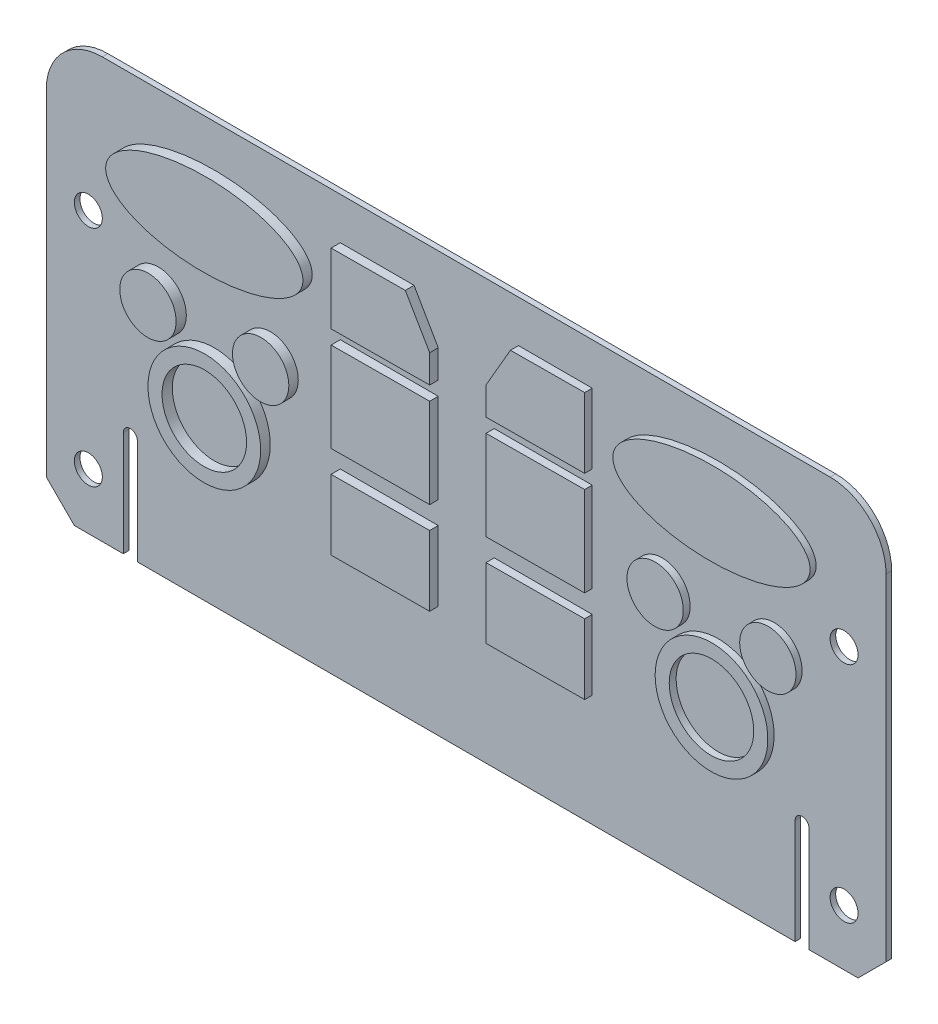
from build123d import *

# Parameters (mm, degrees)
SKETCH1_W           = 300
SKETCH1_H           = 150
PCB_BASE_DEPTH      = 2
SKETCH4_R           = 10
SKETCH4_R_2         = 20
SKETCH4_R_3         = 15
SKETCH4_RX          = 35
SKETCH4_RY          = 15
SKETCH4_W           = 35
SKETCH4_H           = 25
SKETCH4_H_2         = 32
BOSS_EXTRUDE3_DEPTH = 4
CUT_EXTRUDE1_REACH  = 337.461
SKETCH5_R           = 5
SKETCH5_W           = 5
SKETCH5_H           = 37.5
FILLET1_R           = 20
SKETCH6_W           = 2
SKETCH6_H           = 25
CUT_EXTRUDE2_DEPTH  = 0.01


with BuildPart() as part:
    # Sketch1 → PCB Base (new body)
    with BuildSketch(Plane.XY):
        with Locations((-150, 75)):
            Rectangle(SKETCH1_W, SKETCH1_H)
    extrude(amount=PCB_BASE_DEPTH)

    # Sketch4 → Boss-Extrude3 (add)
    # profile 1 of 14: a face of its own
    with BuildSketch(Plane(origin=(0, 0, 0), x_dir=(-1, 0, 0), z_dir=(0, 0, -1))):
        with Locations(Location((40, 85, 0), (0, 0, 180))):
            Circle(SKETCH4_R)
    # profile 2 of 14: a face of its own
    with BuildSketch(Plane(origin=(0, 0, 0), x_dir=(-1, 0, 0), z_dir=(0, 0, -1))):
        with Locations(Location((80, 85, 0), (0, 0, 180))):
            Circle(SKETCH4_R)
    # profile 3 of 14: a face of its own
    with BuildSketch(Plane(origin=(0, 0, 0), x_dir=(-1, 0, 0), z_dir=(0, 0, -1))):
        with Locations(Location((60, 60, 0), (0, 0, 180))):
            Circle(SKETCH4_R_2)
        with Locations((60, 60)):
            Circle(SKETCH4_R_3, mode=Mode.SUBTRACT)
    # profile 4 of 14: a face of its own
    with BuildSketch(Plane(origin=(0, 0, 0), x_dir=(-1, 0, 0), z_dir=(0, 0, -1))):
        with Locations(Location((240, 60, 0), (0, 0, 180))):
            Circle(SKETCH4_R_2)
        with Locations(Location((240, 60, 0), (0, 0, 180))):
            Circle(SKETCH4_R_3, mode=Mode.SUBTRACT)
    # profile 5 of 14: a face of its own
    with BuildSketch(Plane(origin=(0, 0, 0), x_dir=(-1, 0, 0), z_dir=(0, 0, -1))):
        with Locations(Location((220, 85, 0), (0, 0, 180))):
            Circle(SKETCH4_R)
    # profile 6 of 14: a face of its own
    with BuildSketch(Plane(origin=(0, 0, 0), x_dir=(-1, 0, 0), z_dir=(0, 0, -1))):
        with Locations(Location((260, 85, 0), (0, 0, 180))):
            Circle(SKETCH4_R)
    # profile 7 of 14: a face of its own
    with BuildSketch(Plane(origin=(0, 0, 0), x_dir=(-1, 0, 0), z_dir=(0, 0, -1))):
        with Locations((60, 120)):
            Ellipse(SKETCH4_RX, SKETCH4_RY)
    # profile 8 of 14: a face of its own
    with BuildSketch(Plane(origin=(0, 0, 0), x_dir=(-1, 0, 0), z_dir=(0, 0, -1))):
        with Locations(Location((240, 120), (0, 0, 180))):
            Ellipse(SKETCH4_RX, SKETCH4_RY)
    # profile 9 of 14: a face of its own
    with BuildSketch(Plane(origin=(0, 0, 0), x_dir=(-1, 0, 0), z_dir=(0, 0, -1))):
        Polygon((140, 120), (131.339745962, 135), (105, 135), (105, 110), (140, 110), align=None)
    # profile 10 of 14: a face of its own
    with BuildSketch(Plane(origin=(0, 0, 0), x_dir=(-1, 0, 0), z_dir=(0, 0, -1))):
        with Locations((122.5, 52.5)):
            Rectangle(SKETCH4_W, SKETCH4_H)
    # profile 11 of 14: a face of its own
    with BuildSketch(Plane(origin=(0, 0, 0), x_dir=(-1, 0, 0), z_dir=(0, 0, -1))):
        with Locations((122.5, 89)):
            Rectangle(SKETCH4_W, SKETCH4_H_2)
    # profile 12 of 14: a face of its own
    with BuildSketch(Plane(origin=(0, 0, 0), x_dir=(-1, 0, 0), z_dir=(0, 0, -1))):
        Polygon((160, 110), (160, 120), (168.660254038, 135), (195, 135), (195, 110), align=None)
    # profile 13 of 14: a face of its own
    with BuildSketch(Plane(origin=(0, 0, 0), x_dir=(-1, 0, 0), z_dir=(0, 0, -1))):
        with Locations((177.5, 89)):
            Rectangle(SKETCH4_W, SKETCH4_H_2)
    # profile 14 of 14: a face of its own
    with BuildSketch(Plane(origin=(0, 0, 0), x_dir=(-1, 0, 0), z_dir=(0, 0, -1))):
        with Locations((177.5, 52.5)):
            Rectangle(SKETCH4_W, SKETCH4_H)
    boss_extrude3 = extrude(amount=BOSS_EXTRUDE3_DEPTH)

    # Mirror1: Boss-Extrude3 across plane
    add(boss_extrude3.mirror(Plane(origin=(0, 0, 0), x_dir=(0.9999944444907404, 0, -0.0033333148149691356), z_dir=(-0.0033333148149691347, 0, -0.9999944444907405))))

    # Sketch5 → Cut-Extrude1 (cut, up to next)
    with BuildSketch(Plane(origin=(0, 0, 0), x_dir=(-1, 0, 0), z_dir=(0, 0, -1)), mode=Mode.PRIVATE) as cut_extrude1_sk1:
        with Locations((15, 100)):
            Circle(SKETCH5_R)
    cut_extrude1_tool1 = extrude(cut_extrude1_sk1.sketch, amount=-CUT_EXTRUDE1_REACH, mode=Mode.PRIVATE) & part.part
    # Sketch5 → Cut-Extrude1 (cut, up to next)
    with BuildSketch(Plane(origin=(0, 0, 0), x_dir=(-1, 0, 0), z_dir=(0, 0, -1)), mode=Mode.PRIVATE) as cut_extrude1_sk2:
        with Locations((15, 20)):
            Circle(SKETCH5_R)
    cut_extrude1_tool2 = extrude(cut_extrude1_sk2.sketch, amount=-CUT_EXTRUDE1_REACH, mode=Mode.PRIVATE) & part.part
    # Sketch5 → Cut-Extrude1 (cut, up to next)
    with BuildSketch(Plane(origin=(0, 0, 0), x_dir=(-1, 0, 0), z_dir=(0, 0, -1)), mode=Mode.PRIVATE) as cut_extrude1_sk3:
        Polygon((0, 0), (10, 0), (0, 10), align=None)
    cut_extrude1_tool3 = extrude(cut_extrude1_sk3.sketch, amount=-CUT_EXTRUDE1_REACH, mode=Mode.PRIVATE) & part.part
    # Sketch5 → Cut-Extrude1 (cut, up to next)
    with BuildSketch(Plane(origin=(0, 0, 0), x_dir=(-1, 0, 0), z_dir=(0, 0, -1)), mode=Mode.PRIVATE) as cut_extrude1_sk4:
        with Locations((30, 18.75)):
            Rectangle(SKETCH5_W, SKETCH5_H)
    cut_extrude1_tool4 = extrude(cut_extrude1_sk4.sketch, amount=-CUT_EXTRUDE1_REACH, mode=Mode.PRIVATE) & part.part
    # Sketch5 → Cut-Extrude1 (cut, up to next)
    with BuildSketch(Plane(origin=(0, 0, 0), x_dir=(-1, 0, 0), z_dir=(0, 0, -1)), mode=Mode.PRIVATE) as cut_extrude1_sk5:
        with BuildLine():
            Line((27.5, 37.5), (32.5, 37.5))
            ThreePointArc((32.5, 37.5), (30, 40), (27.5, 37.5))
        make_face()
    cut_extrude1_tool5 = extrude(cut_extrude1_sk5.sketch, amount=-CUT_EXTRUDE1_REACH, mode=Mode.PRIVATE) & part.part
    # Sketch5 → Cut-Extrude1 (cut, up to next)
    with BuildSketch(Plane(origin=(0, 0, 0), x_dir=(-1, 0, 0), z_dir=(0, 0, -1)), mode=Mode.PRIVATE) as cut_extrude1_sk6:
        with Locations((285, 100)):
            Circle(SKETCH5_R)
    cut_extrude1_tool6 = extrude(cut_extrude1_sk6.sketch, amount=-CUT_EXTRUDE1_REACH, mode=Mode.PRIVATE) & part.part
    # Sketch5 → Cut-Extrude1 (cut, up to next)
    with BuildSketch(Plane(origin=(0, 0, 0), x_dir=(-1, 0, 0), z_dir=(0, 0, -1)), mode=Mode.PRIVATE) as cut_extrude1_sk7:
        with Locations((285, 20)):
            Circle(SKETCH5_R)
    cut_extrude1_tool7 = extrude(cut_extrude1_sk7.sketch, amount=-CUT_EXTRUDE1_REACH, mode=Mode.PRIVATE) & part.part
    # Sketch5 → Cut-Extrude1 (cut, up to next)
    with BuildSketch(Plane(origin=(0, 0, 0), x_dir=(-1, 0, 0), z_dir=(0, 0, -1)), mode=Mode.PRIVATE) as cut_extrude1_sk8:
        Polygon((300, 10), (290, 0), (300, 0), align=None)
    cut_extrude1_tool8 = extrude(cut_extrude1_sk8.sketch, amount=-CUT_EXTRUDE1_REACH, mode=Mode.PRIVATE) & part.part
    # Sketch5 → Cut-Extrude1 (cut, up to next)
    with BuildSketch(Plane(origin=(0, 0, 0), x_dir=(-1, 0, 0), z_dir=(0, 0, -1)), mode=Mode.PRIVATE) as cut_extrude1_sk9:
        with Locations((270, 18.75)):
            Rectangle(SKETCH5_W, SKETCH5_H)
    cut_extrude1_tool9 = extrude(cut_extrude1_sk9.sketch, amount=-CUT_EXTRUDE1_REACH, mode=Mode.PRIVATE) & part.part
    # Sketch5 → Cut-Extrude1 (cut, up to next)
    with BuildSketch(Plane(origin=(0, 0, 0), x_dir=(-1, 0, 0), z_dir=(0, 0, -1)), mode=Mode.PRIVATE) as cut_extrude1_sk10:
        with BuildLine():
            ThreePointArc((267.5, 37.5), (270, 40), (272.5, 37.5))
            Line((272.5, 37.5), (267.5, 37.5))
        make_face()
    cut_extrude1_tool10 = extrude(cut_extrude1_sk10.sketch, amount=-CUT_EXTRUDE1_REACH, mode=Mode.PRIVATE) & part.part
    add(cut_extrude1_tool1.solids().sort_by_distance((-15, 100, 0))[0], mode=Mode.SUBTRACT)
    add(cut_extrude1_tool2.solids().sort_by_distance((-15, 20, 0))[0], mode=Mode.SUBTRACT)
    add(cut_extrude1_tool3.solids().sort_by_distance((-3.333333, 3.333333, 0))[0], mode=Mode.SUBTRACT)
    add(cut_extrude1_tool4.solids().sort_by_distance((-30, 18.75, 0))[0], mode=Mode.SUBTRACT)
    add(cut_extrude1_tool5.solids().sort_by_distance((-30, 38.561033, 0))[0], mode=Mode.SUBTRACT)
    add(cut_extrude1_tool6.solids().sort_by_distance((-285, 100, 0))[0], mode=Mode.SUBTRACT)
    add(cut_extrude1_tool7.solids().sort_by_distance((-285, 20, 0))[0], mode=Mode.SUBTRACT)
    add(cut_extrude1_tool8.solids().sort_by_distance((-296.666667, 3.333333, 0))[0], mode=Mode.SUBTRACT)
    add(cut_extrude1_tool9.solids().sort_by_distance((-270, 18.75, 0))[0], mode=Mode.SUBTRACT)
    add(cut_extrude1_tool10.solids().sort_by_distance((-270, 38.561033, 0))[0], mode=Mode.SUBTRACT)

    # Fillet1
    fillet1_edges = [part.edges().sort_by_distance(p)[0] for p in [
        (-300, 150, 1),
        (0, 150, 1),
    ]]
    fillet(fillet1_edges, radius=FILLET1_R)

    # Sketch6 → Cut-Extrude2 (cut)
    with BuildSketch(Plane(origin=(0, 0, 0), x_dir=(-1, 0, 0), z_dir=(0, 0, -1))):
        with Locations((40, 12.5)):
            Rectangle(SKETCH6_W, SKETCH6_H)
        with Locations((45, 12.5)):
            Rectangle(SKETCH6_W, SKETCH6_H)
        with Locations((50, 12.5)):
            Rectangle(SKETCH6_W, SKETCH6_H)
        with Locations((55, 12.5)):
            Rectangle(SKETCH6_W, SKETCH6_H)
        with Locations((60, 12.5)):
            Rectangle(SKETCH6_W, SKETCH6_H)
        with Locations((65, 12.5)):
            Rectangle(SKETCH6_W, SKETCH6_H)
        with Locations((70, 12.5)):
            Rectangle(SKETCH6_W, SKETCH6_H)
        with Locations((75, 12.5)):
            Rectangle(SKETCH6_W, SKETCH6_H)
        with Locations((80, 12.5)):
            Rectangle(SKETCH6_W, SKETCH6_H)
        with Locations((85, 12.5)):
            Rectangle(SKETCH6_W, SKETCH6_H)
        with Locations((90, 12.5)):
            Rectangle(SKETCH6_W, SKETCH6_H)
        with Locations((95, 12.5)):
            Rectangle(SKETCH6_W, SKETCH6_H)
        with Locations((100, 12.5)):
            Rectangle(SKETCH6_W, SKETCH6_H)
        with Locations((105, 12.5)):
            Rectangle(SKETCH6_W, SKETCH6_H)
        with Locations((110, 12.5)):
            Rectangle(SKETCH6_W, SKETCH6_H)
        with Locations((115, 12.5)):
            Rectangle(SKETCH6_W, SKETCH6_H)
        with Locations((120, 12.5)):
            Rectangle(SKETCH6_W, SKETCH6_H)
        with Locations((125, 12.5)):
            Rectangle(SKETCH6_W, SKETCH6_H)
        with Locations((130, 12.5)):
            Rectangle(SKETCH6_W, SKETCH6_H)
        with Locations((135, 12.5)):
            Rectangle(SKETCH6_W, SKETCH6_H)
        with Locations((140, 12.5)):
            Rectangle(SKETCH6_W, SKETCH6_H)
        with Locations((145, 12.5)):
            Rectangle(SKETCH6_W, SKETCH6_H)
        with Locations((150, 12.5)):
            Rectangle(SKETCH6_W, SKETCH6_H)
        with Locations((155, 12.5)):
            Rectangle(SKETCH6_W, SKETCH6_H)
        with Locations((160, 12.5)):
            Rectangle(SKETCH6_W, SKETCH6_H)
        with Locations((165, 12.5)):
            Rectangle(SKETCH6_W, SKETCH6_H)
        with Locations((170, 12.5)):
            Rectangle(SKETCH6_W, SKETCH6_H)
        with Locations((175, 12.5)):
            Rectangle(SKETCH6_W, SKETCH6_H)
        with Locations((180, 12.5)):
            Rectangle(SKETCH6_W, SKETCH6_H)
        with Locations((185, 12.5)):
            Rectangle(SKETCH6_W, SKETCH6_H)
        with Locations((190, 12.5)):
            Rectangle(SKETCH6_W, SKETCH6_H)
        with Locations((195, 12.5)):
            Rectangle(SKETCH6_W, SKETCH6_H)
        with Locations((200, 12.5)):
            Rectangle(SKETCH6_W, SKETCH6_H)
        with Locations((205, 12.5)):
            Rectangle(SKETCH6_W, SKETCH6_H)
        with Locations((210, 12.5)):
            Rectangle(SKETCH6_W, SKETCH6_H)
        with Locations((215, 12.5)):
            Rectangle(SKETCH6_W, SKETCH6_H)
        with Locations((220, 12.5)):
            Rectangle(SKETCH6_W, SKETCH6_H)
        with Locations((225, 12.5)):
            Rectangle(SKETCH6_W, SKETCH6_H)
        with Locations((230, 12.5)):
            Rectangle(SKETCH6_W, SKETCH6_H)
        with Locations((235, 12.5)):
            Rectangle(SKETCH6_W, SKETCH6_H)
        with Locations((240, 12.5)):
            Rectangle(SKETCH6_W, SKETCH6_H)
        with Locations((245, 12.5)):
            Rectangle(SKETCH6_W, SKETCH6_H)
        with Locations((250, 12.5)):
            Rectangle(SKETCH6_W, SKETCH6_H)
        with Locations((255, 12.5)):
            Rectangle(SKETCH6_W, SKETCH6_H)
        with Locations((260, 12.5)):
            Rectangle(SKETCH6_W, SKETCH6_H)
    extrude(amount=-CUT_EXTRUDE2_DEPTH, mode=Mode.SUBTRACT)


solid = part.part
